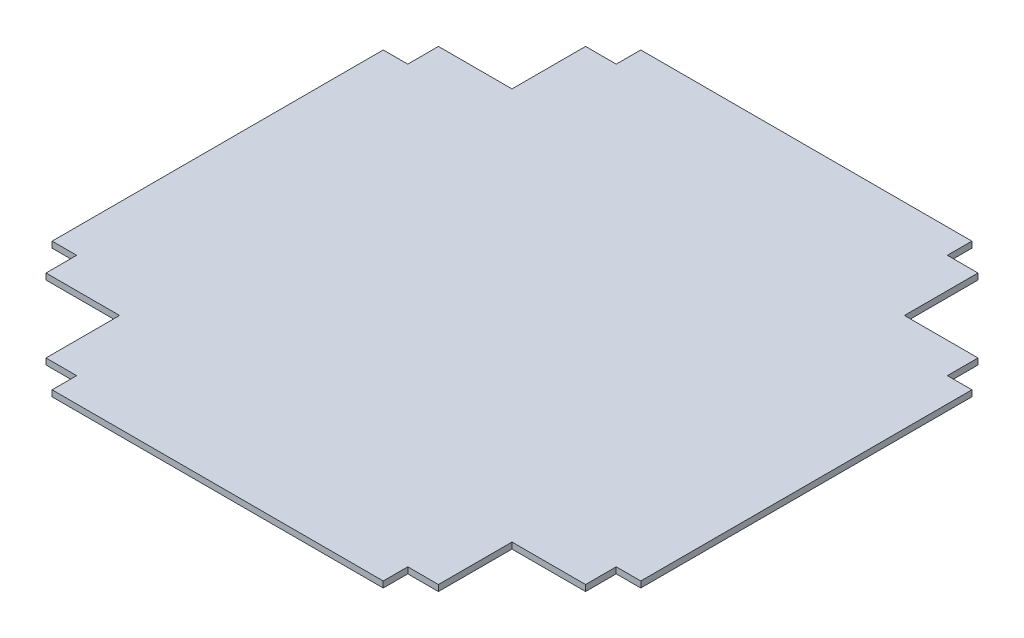
from build123d import *

# Parameters (mm, degrees)
SKETCH1_W           = 609.6
SKETCH1_H           = 609.6
BOSS_EXTRUDE1_DEPTH = 6.35
CUT_EXTRUDE1_DEPTH  = 863.127973389


with BuildPart() as part:
    # Sketch1 → Boss-Extrude1 (new body)
    with BuildSketch(Plane(origin=(0, 0, 0), x_dir=(1, 0, 0), z_dir=(0, 1, 0))):
        with Locations((304.8, 304.8)):
            Rectangle(SKETCH1_W, SKETCH1_H)
    extrude(amount=BOSS_EXTRUDE1_DEPTH)

    # Sketch2 → Cut-Extrude1 (cut, through all)
    with BuildSketch(Plane(origin=(0, 6.35, 0), x_dir=(1, 0, 0), z_dir=(0, 1, 0))):
        Polygon((609.6, 0), (476.25, 0), (476.25, 25.4), (508, 25.4), (508, 101.6), (584.2, 101.6), (584.2, 133.35), (609.6, 133.35), align=None)
        Polygon((0, 133.35), (0, 0), (133.35, 0), (133.35, 25.4), (101.6, 25.4), (101.6, 101.6), (25.4, 101.6), (25.4, 133.35), align=None)
        Polygon((0, 609.6), (133.35, 609.6), (133.35, 584.2), (101.6, 584.2), (101.6, 508), (25.4, 508), (25.4, 476.25), (0, 476.25), align=None)
        Polygon((609.6, 476.25), (609.6, 609.6), (476.25, 609.6), (476.25, 584.2), (508, 584.2), (508, 508), (584.2, 508), (584.2, 476.25), align=None)
    extrude(amount=-CUT_EXTRUDE1_DEPTH, mode=Mode.SUBTRACT)


solid = part.part
